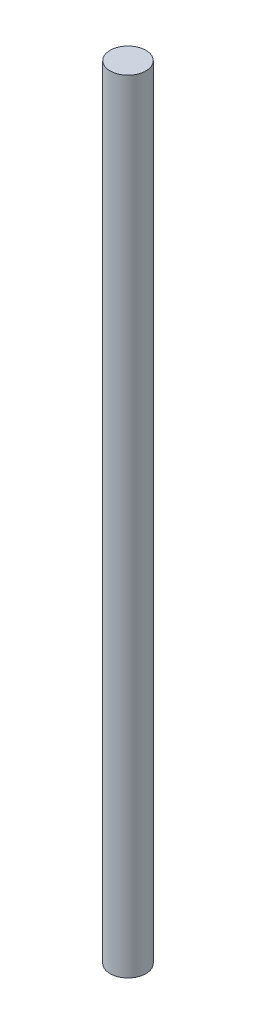
from build123d import *

# Parameters (mm, degrees)
SKETCH1_R           = 4
BOSS_EXTRUDE1_DEPTH = 175


with BuildPart() as part:
    # Sketch1 → Boss-Extrude1 (new body)
    with BuildSketch(Plane(origin=(0, 0, 0), x_dir=(1, 0, 0), z_dir=(0, 1, 0))):
        with Locations(Location((0, 0, 0), (0, 0, 270))):
            Circle(SKETCH1_R)
    extrude(amount=BOSS_EXTRUDE1_DEPTH)


solid = part.part
